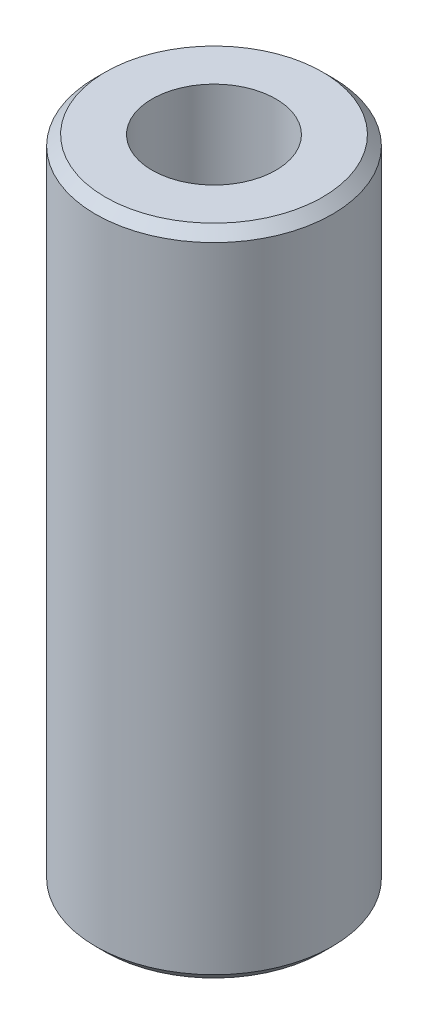
from build123d import *

# Parameters (mm, degrees)
CROQUIS2_R                = 4.7625
SALIENTE_EXTRUIR1_DEPTH   = 13.15085
CHAFL_N1_SIZE             = 0.396875
CLEARANCE_HOLE_DEPTH      = 15.775238347
CLEARANCE_HOLE_DEPTH_BACK = 15.775238347
CROQUIS4_R                = 2.4892


with BuildPart() as part:
    # Croquis2 → Saliente-Extruir1 (new, symmetric)
    with BuildSketch(Plane(origin=(0, 0, 0), x_dir=(1, 0, 0), z_dir=(0, 1, 0))):
        Circle(CROQUIS2_R)
    extrude(amount=SALIENTE_EXTRUIR1_DEPTH, both=True)

    # Chaflán1
    chafl_n1_edges = [part.edges().sort_by_distance(p)[0] for p in [
        (-4.7625, -13.15085, 0),
        (-4.7625, 13.15085, 0),
    ]]
    chamfer(chafl_n1_edges, length=CHAFL_N1_SIZE)

    # Croquis4 → Clearance Hole (cut, two sides: drawn at the far end of the back side and taken through both)
    with BuildSketch(Plane(origin=(0, 0, 0), x_dir=(1, 0, 0), z_dir=(0, 1, 0)).offset(-CLEARANCE_HOLE_DEPTH_BACK)):
        Circle(CROQUIS4_R)
    extrude(amount=CLEARANCE_HOLE_DEPTH + CLEARANCE_HOLE_DEPTH_BACK, mode=Mode.SUBTRACT)


solid = part.part
